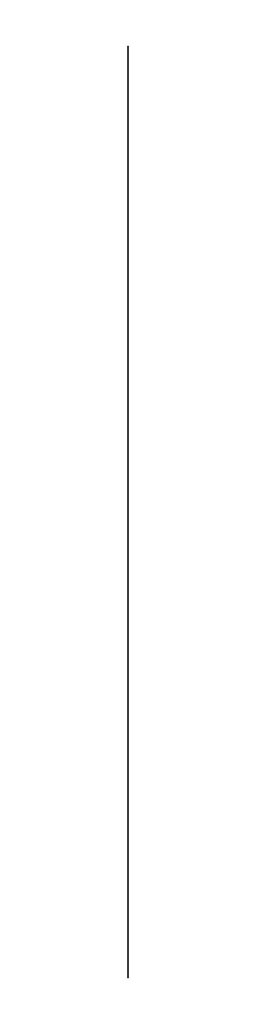
from build123d import *

# Parameters (mm, degrees)
SKETCH1_R           = 0.05
BOSS_EXTRUDE1_DEPTH = 200


with BuildPart() as part:
    # Sketch1 → Boss-Extrude1 (new body)
    with BuildSketch(Plane(origin=(0, 0, 0), x_dir=(1, 0, 0), z_dir=(0, 1, 0))):
        with Locations(Location((0, 0, 0), (0, 0, 270))):
            Circle(SKETCH1_R)
    extrude(amount=BOSS_EXTRUDE1_DEPTH)


solid = part.part
